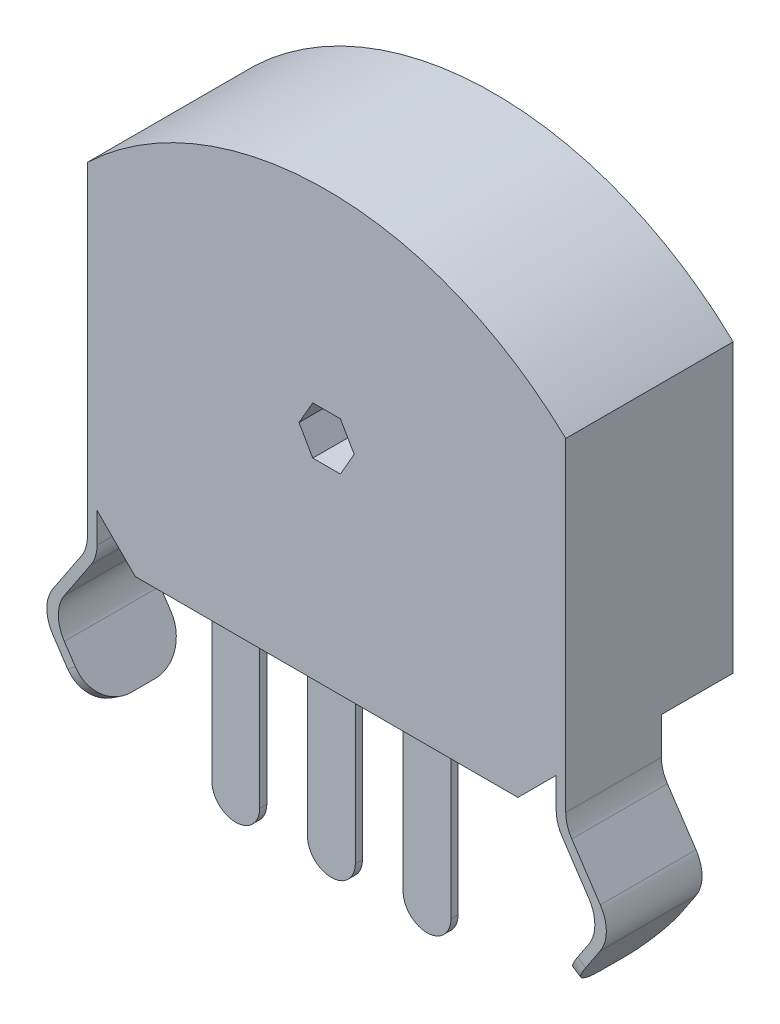
from build123d import *

# Parameters (mm, degrees)
BOSS_EXTRU_1_DEPTH             = 3.5
ESQUISSE2_R                    = 1.75
BOSS_EXTRU_2_DEPTH             = 0.5
CONG_1_R                       = 0.25
BOSS_EXTRU_3_START             = -0.1
BOSS_EXTRU_3_DEPTH             = 0.15
R_P_TITION_LIN_AIRE1_COUNT     = 2
R_P_TITION_LIN_AIRE1_PITCH     = 2
R_P_TITION_LIN_AIRE1_COL_COUNT = 2
R_P_TITION_LIN_AIRE1_COL_PITCH = 2
CHANFREIN1_SIZE                = 1
EXTRU_MINCE1_DEPTH             = 2
CONG_2_R                       = 0.75
CONG_3_R                       = 0.75


with BuildPart() as part:
    # Esquisse1 → Boss.-Extru.1 (new body)
    with BuildSketch(Plane.XY):
        with BuildLine():
            Line((-5, 2.5), (-5, -4.5))
            Line((-5, -4.5), (5, -4.5))
            Line((5, -4.5), (5, 2.5))
            ThreePointArc((5, 2.5), (2.692582404, 3.981456009), (0, 4.5))
            ThreePointArc((0, 4.5), (-2.692582404, 3.981456009), (-5, 2.5))
        make_face()
        Polygon((-0.288675135, 0.5), (-0.577350269, 0), (-0.288675135, -0.5), (0.288675135, -0.5), (0.577350269, 0), (0.288675135, 0.5), align=None, mode=Mode.SUBTRACT)
    extrude(amount=BOSS_EXTRU_1_DEPTH)

    # Esquisse2 → Boss.-Extru.2 (add)
    with BuildSketch(Plane.XY):
        Circle(ESQUISSE2_R)
        Polygon((-0.577350269, 0), (-0.288675135, -0.5), (0.288675135, -0.5), (0.577350269, 0), (0.288675135, 0.5), (-0.288675135, 0.5), align=None, mode=Mode.SUBTRACT)
    extrude(amount=-BOSS_EXTRU_2_DEPTH)

    # Congé1
    cong_1_edges = [part.edges().sort_by_distance(p)[0] for p in [
        (-1.75, 0, 0),
    ]]
    fillet(cong_1_edges, radius=CONG_1_R)

    # Esquisse3 → Boss.-Extru.3 (add)
    with BuildSketch(Plane.XY.offset(3.5).offset(BOSS_EXTRU_3_START)):
        with BuildLine():
            Line((-0.5, -4.5), (-0.5, -7.5))
            ThreePointArc((-0.5, -7.5), (0, -8), (0.5, -7.5))
            Line((0.5, -7.5), (0.5, -4.5))
            Line((0.5, -4.5), (-0.5, -4.5))
        make_face()
    boss_extru_3 = extrude(amount=-BOSS_EXTRU_3_DEPTH)

    # Répétition linéaire1: Boss.-Extru.3 ×2
    with Locations(*[(i * R_P_TITION_LIN_AIRE1_PITCH, 0, 0) for i in range(1, R_P_TITION_LIN_AIRE1_COUNT)]):
        add(boss_extru_3)

    # Répétition linéaire1 col: Boss.-Extru.3 ×2
    with Locations(*[(-i * R_P_TITION_LIN_AIRE1_COL_PITCH, 0, 0) for i in range(1, R_P_TITION_LIN_AIRE1_COL_COUNT)]):
        add(boss_extru_3)

    # Chanfrein1
    chanfrein1_edges = [part.edges().sort_by_distance(p)[0] for p in [
        (5, -4.5, 1.75),
        (-5, -4.5, 1.75),
    ]]
    chamfer(chanfrein1_edges, length=CHANFREIN1_SIZE)

    # Esquisse4 → Extru.-Mince1 (add)
    with BuildSketch(Plane.XY.offset(3.5)):
        Polygon((-5, -3.5), (-5, -4.5), (-6, -6), (-5, -7.5), (-4.833589941, -7.389059961), (-5.759629915, -6), (-4.8, -4.560555128), (-4.8, -3.5), align=None)
    extru_mince1 = extrude(amount=-EXTRU_MINCE1_DEPTH)

    # Symétrie1: Extru.-Mince1 across plane
    add(extru_mince1.mirror(Plane.ZY))

    # Congé2
    cong_2_edges = [part.edges().sort_by_distance(p)[0] for p in [
        (-4.916794971, -7.44452998, 3.5),
        (-4.916794971, -7.44452998, 1.5),
        (4.916794971, -7.44452998, 1.5),
        (4.916794971, -7.44452998, 3.5),
    ]]
    fillet(cong_2_edges, radius=CONG_2_R)

    # Congé3
    cong_3_edges = [part.edges().sort_by_distance(p)[0] for p in [
        (-6, -6, 2.5),
        (-5, -4.5, 2.5),
        (-4.8, -4.560555128, 2.5),
        (-5.759629915, -6, 2.5),
        (6, -6, 2.5),
        (5.759629915, -6, 2.5),
        (4.8, -4.560555128, 2.5),
        (5, -4.5, 2.5),
    ]]
    fillet(cong_3_edges, radius=CONG_3_R)


solid = part.part
